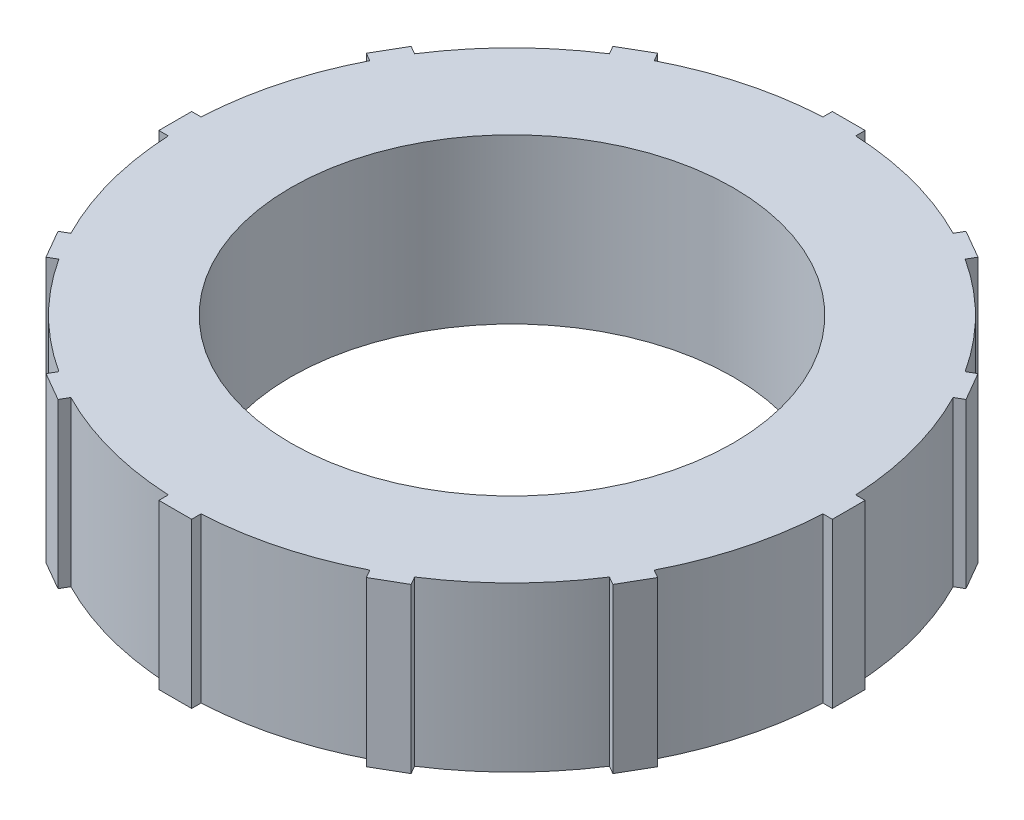
from build123d import *

# Parameters (mm, degrees)
TYRE_BASE_SKETCH_R     = 40
TYRE_BASE_DEPTH        = 20
RIM_BORE_SKETCH_R      = 27
RIM_BORE_DEPTH         = 20.2
TREAD_RIB_SKETCH_W     = 3.2
TREAD_RIB_SKETCH_H     = 20
TREAD_RIB_DEPTH        = 4
CIRCULARPATTERN1_COUNT = 12


with BuildPart() as part:
    # Tyre base sketch → Tyre base (new body)
    with BuildSketch(Plane(origin=(0, -283, 0), x_dir=(1, 0, 0), z_dir=(0, 1, 0))):
        with Locations((-19.009182883, 53.244882879)):
            Circle(TYRE_BASE_SKETCH_R)
    extrude(amount=TYRE_BASE_DEPTH)

    # Rim bore sketch → Rim bore (cut)
    with BuildSketch(Plane(origin=(0, -283.1, 0), x_dir=(1, 0, 0), z_dir=(0, 1, 0))):
        with Locations((-19.009182883, 53.244882879)):
            Circle(RIM_BORE_SKETCH_R)
    extrude(amount=RIM_BORE_DEPTH, mode=Mode.SUBTRACT)

    # Tread rib sketch → Tread rib (add)
    with BuildSketch(Plane.XY.offset(-55.244882879)):
        with Locations((20.490817117, -273)):
            Rectangle(TREAD_RIB_SKETCH_W, TREAD_RIB_SKETCH_H)
    tread_rib = extrude(amount=TREAD_RIB_DEPTH)

    # CircularPattern1: Tread rib ×12 about axis
    circularpattern1_axis = Axis((-19.009182883, -10, -53.244882879), (0, 1, 0))
    for i in range(1, CIRCULARPATTERN1_COUNT):
        add(tread_rib.rotate(circularpattern1_axis, i * 360 / CIRCULARPATTERN1_COUNT))


solid = part.part
